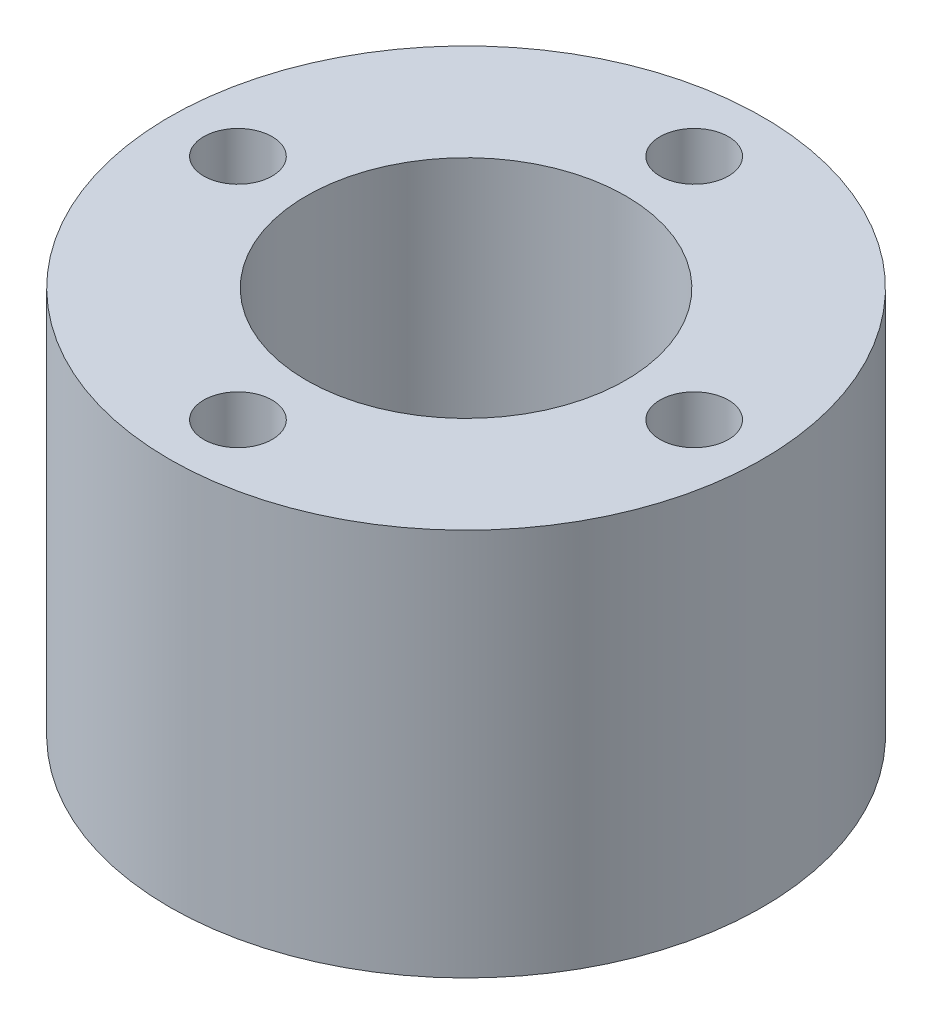
from build123d import *

# Parameters (mm, degrees)
SKETCH_1_R      = 13
SKETCH_1_R_2    = 7
SKETCH_1_R_3    = 1.5
EXTRUDE_1_DEPTH = 17


with BuildPart() as part:
    # 草图1 → 凸台-拉伸1 (new body)
    with BuildSketch(Plane(origin=(0, 0, 0), x_dir=(1, 0, 0), z_dir=(0, 1, 0))):
        with Locations(Location((0, 0, 0), (0, 0, 270))):
            Circle(SKETCH_1_R)
        with Locations(Location((0, 0, 0), (0, 0, 270))):
            Circle(SKETCH_1_R_2, mode=Mode.SUBTRACT)
        with Locations(Location((0, 10, 0), (0, 0, 270))):
            Circle(SKETCH_1_R_3, mode=Mode.SUBTRACT)
        with Locations(Location((10, 0, 0), (0, 0, 270))):
            Circle(SKETCH_1_R_3, mode=Mode.SUBTRACT)
        with Locations(Location((0, -10, 0), (0, 0, 270))):
            Circle(SKETCH_1_R_3, mode=Mode.SUBTRACT)
        with Locations(Location((-10, 0, 0), (0, 0, 270))):
            Circle(SKETCH_1_R_3, mode=Mode.SUBTRACT)
    extrude(amount=EXTRUDE_1_DEPTH)


solid = part.part
